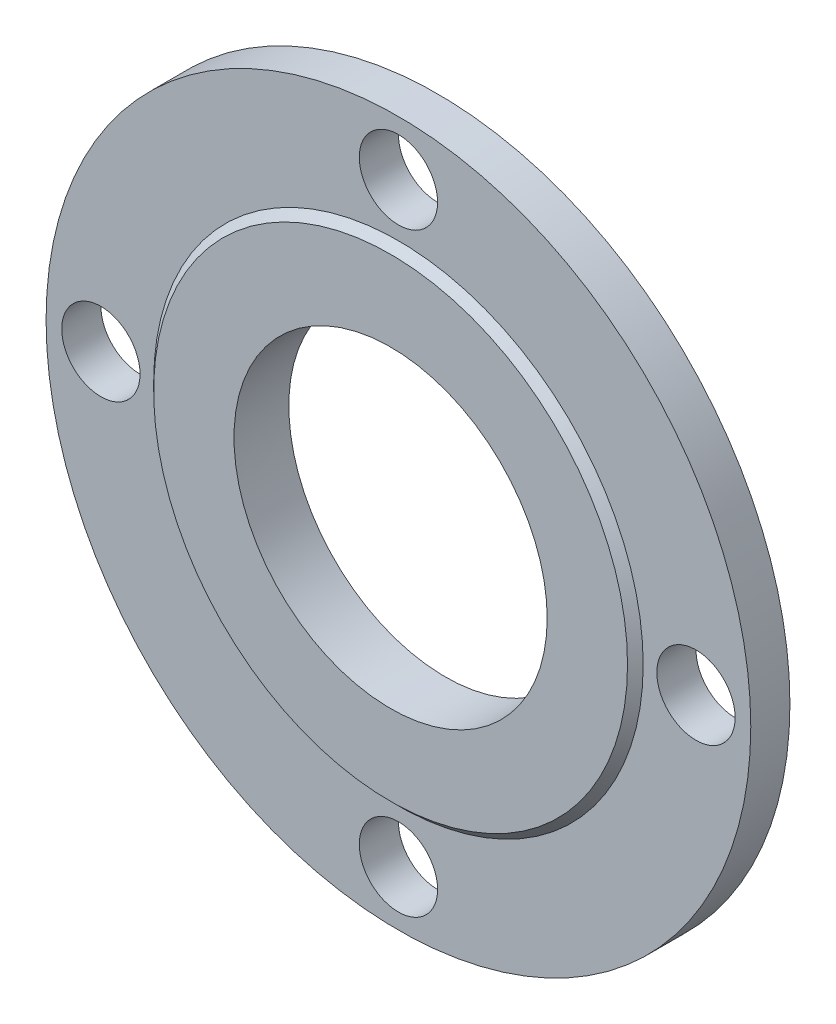
from build123d import *

# Parameters (mm, degrees)
SKETCH1_R               = 28.575
SKETCH1_R_2             = 12.7
BOSS_EXTRUDE1_DEPTH     = 1.5875
SKETCH8_R               = 19.8501
SKETCH8_R_2             = 12.7
BOSS_EXTRUDE2_DEPTH     = 2.2225
CHAMFER1_SIZE           = 0.635
CUT_EXTRUDE1_DEPTH      = 41.472222033
CUT_EXTRUDE1_DEPTH_BACK = 41.472222033
SKETCH9_R               = 19.8501
SKETCH10_R              = 3.175
CUT_EXTRUDE2_DEPTH      = 41.590360309


with BuildPart() as part:
    # Sketch1 → Boss-Extrude1 (new, symmetric)
    with BuildSketch(Plane.XY):
        Circle(SKETCH1_R)
        Circle(SKETCH1_R_2, mode=Mode.SUBTRACT)
    extrude(amount=BOSS_EXTRUDE1_DEPTH, both=True)

    # Sketch9 → Cut-Extrude1 (cut, two sides: drawn at the far end of the back side and taken through both)
    with BuildSketch(Plane.XY.offset(-CUT_EXTRUDE1_DEPTH_BACK)):
        Circle(SKETCH9_R)
    extrude(amount=CUT_EXTRUDE1_DEPTH + CUT_EXTRUDE1_DEPTH_BACK, mode=Mode.SUBTRACT)

    # Sketch10 → Cut-Extrude2 (cut, through all)
    with BuildSketch(Plane.XY.offset(1.5875)):
        with Locations((0, 24.13)):
            Circle(SKETCH10_R)
        with Locations((24.13, 0)):
            Circle(SKETCH10_R)
        with Locations((0, -24.13)):
            Circle(SKETCH10_R)
        with Locations((-24.13, 0)):
            Circle(SKETCH10_R)
    extrude(amount=-CUT_EXTRUDE2_DEPTH, mode=Mode.SUBTRACT)


with BuildPart() as body_2:
    # Sketch8 → Boss-Extrude2 (new, symmetric)
    with BuildSketch(Plane.XY):
        Circle(SKETCH8_R)
        Circle(SKETCH8_R_2, mode=Mode.SUBTRACT)
    extrude(amount=BOSS_EXTRUDE2_DEPTH, both=True)

    # Chamfer1
    chamfer1_edges = [body_2.edges().sort_by_distance(p)[0] for p in [
        (-19.8501, 0, -2.2225),
        (-19.8501, 0, 2.2225),
    ]]
    chamfer(chamfer1_edges, length=CHAMFER1_SIZE)


solid = Compound([part.part, body_2.part])
